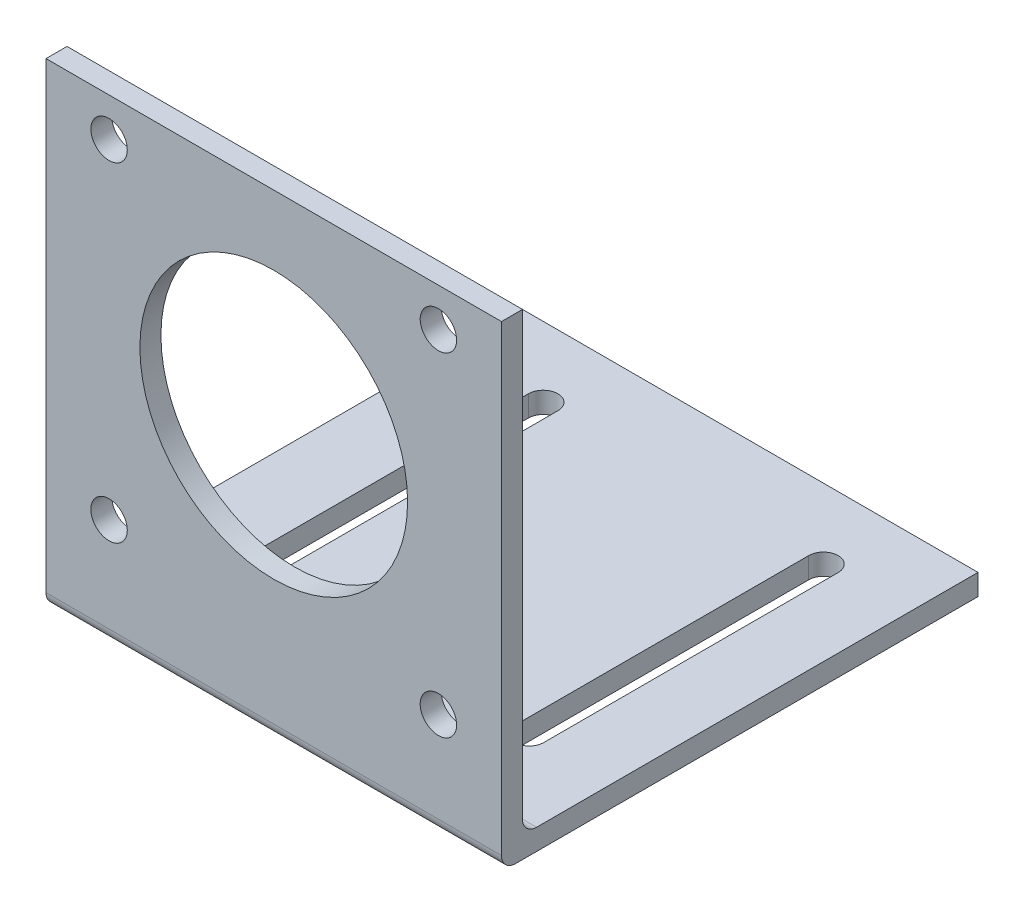
from build123d import *

# Parameters (mm, degrees)
EXTRUDE_1_DEPTH     = 65
CUT_EXTRUDE_1_DEPTH = 115.341593482
SKETCH_3_R          = 19.1
SKETCH_3_R_2        = 2.6
CUT_EXTRUDE_2_DEPTH = 117.073252733


with BuildPart() as part:
    # Эскиз1 → Бобышка-Вытянуть1 (new body)
    with BuildSketch(Plane(origin=(0, 0, 0), x_dir=(0, 0, -1), z_dir=(1, 0, 0))):
        with BuildLine():
            Line((0, 68), (0, 2))
            ThreePointArc((0, 2), (0.585786438, 0.585786438), (2, 0))
            Line((2, 0), (68, 0))
            Line((68, 0), (68, 3))
            Line((68, 3), (5, 3))
            ThreePointArc((5, 3), (3.585786438, 3.585786438), (3, 5))
            Line((3, 5), (3, 68))
            Line((3, 68), (0, 68))
        make_face()
    extrude(amount=EXTRUDE_1_DEPTH)

    # Эскиз2 → Вырез-Вытянуть1 (cut, through all)
    with BuildSketch(Plane(origin=(0, 3, 0), x_dir=(1, 0, 0), z_dir=(0, 1, 0))):
        with BuildLine():
            Line((55.045453811, 58), (55.045453811, 16))
            ThreePointArc((55.045453811, 16), (52.945453811, 13.9), (50.845453811, 16))
            Line((50.845453811, 16), (50.845453811, 58))
            ThreePointArc((50.845453811, 58), (52.945453811, 60.1), (55.045453811, 58))
        make_face()
        with BuildLine():
            Line((10.845453811, 58), (10.845453811, 16))
            ThreePointArc((10.845453811, 16), (12.945453811, 13.9), (15.045453811, 16))
            Line((15.045453811, 16), (15.045453811, 58))
            ThreePointArc((15.045453811, 58), (12.945453811, 60.1), (10.845453811, 58))
        make_face()
    extrude(amount=-CUT_EXTRUDE_1_DEPTH, mode=Mode.SUBTRACT)

    # Эскиз3 → Вырез-Вытянуть2 (cut, through all)
    with BuildSketch(Plane.XY):
        with Locations((32.5, 39)):
            Circle(SKETCH_3_R)
        with Locations((9, 62.5)):
            Circle(SKETCH_3_R_2)
        with Locations((56, 62.5)):
            Circle(SKETCH_3_R_2)
        with Locations((55.996600846, 14.934748787)):
            Circle(SKETCH_3_R_2)
        with Locations((9, 15.5)):
            Circle(SKETCH_3_R_2)
    extrude(amount=-CUT_EXTRUDE_2_DEPTH, mode=Mode.SUBTRACT)


solid = part.part
